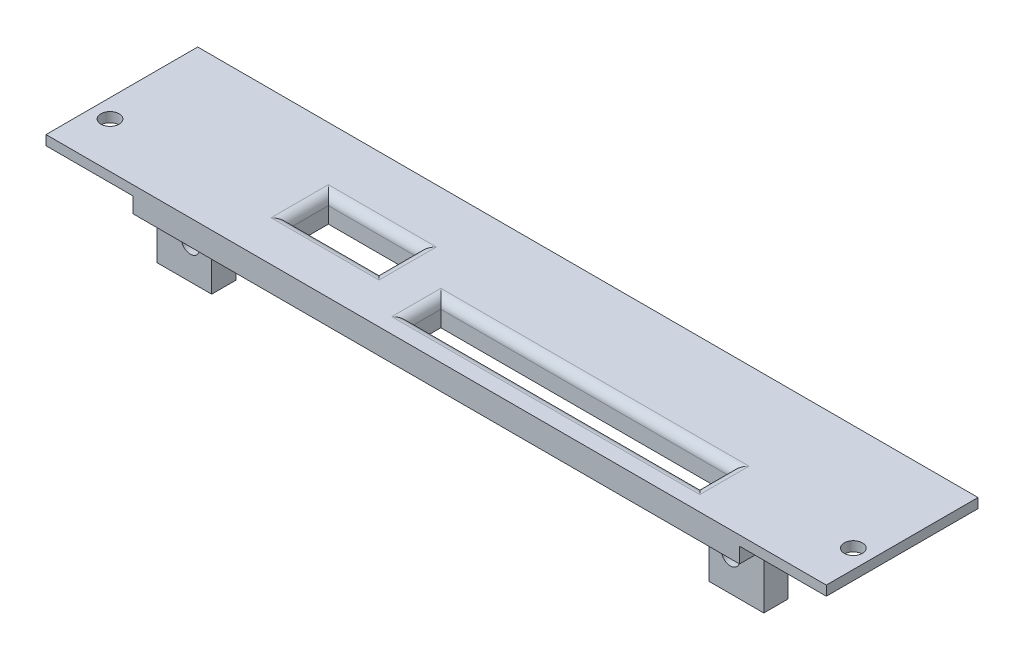
from build123d import *

# Parameters (mm, degrees)
SKETCH1_W           = 128.6
SKETCH1_H           = 25
SKETCH1_R           = 1.5
BOSS_EXTRUDE1_DEPTH = 1.6
SKETCH3_W           = 100
SKETCH3_H           = 25
BOSS_EXTRUDE4_DEPTH = 2.54
SKETCH4_W           = 9
SKETCH4_H           = 9
SKETCH4_R           = 1.5
BOSS_EXTRUDE5_DEPTH = 4
FILLET1_R           = 2
SKETCH5_W           = 47.778525573
SKETCH5_H           = 5.095389146
SKETCH5_W_2         = 14.785547181
SKETCH5_H_2         = 6.451421921
CUT_EXTRUDE1_DEPTH  = 67.808679077
FILLET2_R           = 1.5


with BuildPart() as part:
    # Sketch1 → Boss-Extrude1 (new body)
    with BuildSketch(Plane(origin=(0, 0, 0), x_dir=(1, 0, 0), z_dir=(0, 1, 0))):
        Rectangle(SKETCH1_W, SKETCH1_H)
        with Locations(Location((-61.25, -5, 0), (0, 0, 270))):
            Circle(SKETCH1_R, mode=Mode.SUBTRACT)
        with Locations(Location((61.25, -5, 0), (0, 0, 270))):
            Circle(SKETCH1_R, mode=Mode.SUBTRACT)
    extrude(amount=BOSS_EXTRUDE1_DEPTH)

    # Sketch3 → Boss-Extrude4 (add)
    with BuildSketch(Plane(origin=(0, 0, 0), x_dir=(1, 0, 0), z_dir=(0, 1, 0))):
        Rectangle(SKETCH3_W, SKETCH3_H)
    extrude(amount=-BOSS_EXTRUDE4_DEPTH)

    # Sketch4 → Boss-Extrude5 (add)
    # profile 1 of 2: a face of its own
    with BuildSketch(Plane.XY.offset(8.5)):
        with Locations((-45.5, -7.04)):
            Rectangle(SKETCH4_W, SKETCH4_H)
        with Locations((-44.5, -6.08)):
            Circle(SKETCH4_R, mode=Mode.SUBTRACT)
    # profile 2 of 2: a face of its own
    with BuildSketch(Plane.XY.offset(8.5)):
        with Locations((45.5, -7.04)):
            Rectangle(SKETCH4_W, SKETCH4_H)
        with Locations((44.5, -6.08)):
            Circle(SKETCH4_R, mode=Mode.SUBTRACT)
    extrude(amount=-BOSS_EXTRUDE5_DEPTH)

    # Fillet1
    fillet1_edges = [part.edges().sort_by_distance(p)[0] for p in [
        (-45.5, -2.54, 4.5),
        (45.5, -2.54, 4.5),
    ]]
    fillet(fillet1_edges, radius=FILLET1_R)

    # Sketch5 → Cut-Extrude1 (cut, through all)
    with BuildSketch(Plane(origin=(0, 1.6, 0), x_dir=(1, 0, 0), z_dir=(0, 1, 0))):
        with Locations((15.567152962, -5.952305427)):
            Rectangle(SKETCH5_W, SKETCH5_H)
        with Locations((-24.988389969, -1.104696386)):
            Rectangle(SKETCH5_W_2, SKETCH5_H_2)
    extrude(amount=-CUT_EXTRUDE1_DEPTH, mode=Mode.SUBTRACT)

    # Fillet2
    fillet2_edges = [part.edges().sort_by_distance(p)[0] for p in [
        (-24.988389969, 1.6, 4.330407346),
        (-17.595616378, 1.6, 1.104696385),
        (-24.988389969, 1.6, -2.121014575),
        (-8.322109824, 1.6, 5.952305427),
        (15.567152962, 1.6, 8.5),
        (39.456415749, 1.6, 5.952305427),
        (15.567152962, 1.6, 3.404610854),
        (-32.381163559, 1.6, 1.104696385),
    ]]
    fillet(fillet2_edges, radius=FILLET2_R)


solid = part.part
